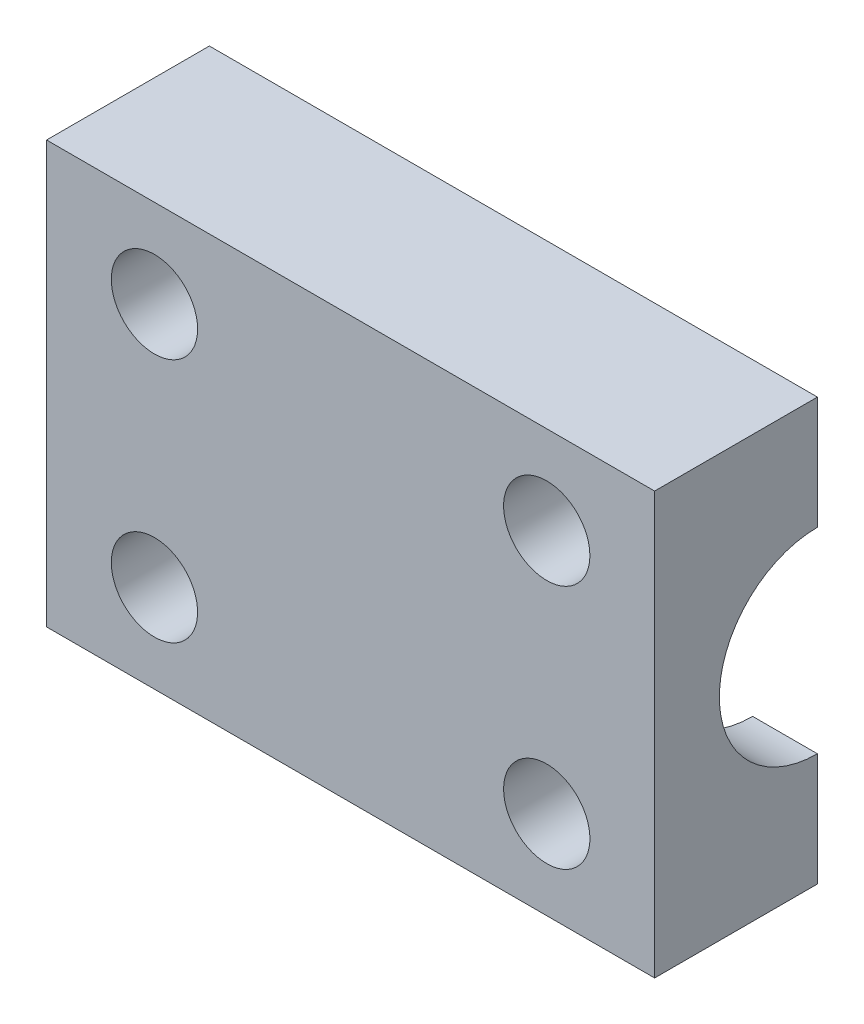
from build123d import *

# Parameters (mm, degrees)
SKETCH1_W           = 31
SKETCH1_H           = 21.5
BOSS_EXTRUDE1_DEPTH = 8.3
CUT_EXTRUDE1_DEPTH  = 6.4
CUT_EXTRUDE2_DEPTH  = 3.5
CUT_EXTRUDE3_DEPTH  = 3.5
SKETCH5_W           = 2.2
SKETCH5_H           = 8.3
SKETCH6_W           = 2.2
SKETCH6_H           = 8.3
SKETCH7_W           = 2.2
SKETCH7_H           = 8.3
SKETCH8_W           = 2.2
SKETCH8_H           = 8.3
SKETCH9_W           = 5
SKETCH9_H           = 12.3
HOLE2_D             = 10
HOLE2_DEPTH         = 31


with BuildPart() as part:
    # Sketch1 → Boss-Extrude1 (new body)
    with BuildSketch(Plane(origin=(0, 0, -8.3), x_dir=(-1, 0, 0), z_dir=(0, 0, -1))):
        with Locations((-2.5, 0)):
            Rectangle(SKETCH1_W, SKETCH1_H)
    extrude(amount=-BOSS_EXTRUDE1_DEPTH)

    # Sketch2 → Cut-Extrude1 (cut)
    with BuildSketch(Plane(origin=(5.7, 0, 0), x_dir=(0, 0, -1), z_dir=(1, 0, 0))):
        Polygon((8.3, -7.523205081), (8.3, 7.523205081), (1.834713282, 3.790470054), (1.834713282, -3.790470054), align=None)
    extrude(amount=-CUT_EXTRUDE1_DEPTH, mode=Mode.SUBTRACT)

    # Sketch3 → Cut-Extrude2 (cut)
    with BuildSketch(Plane(origin=(0, 0, -8.3), x_dir=(-1, 0, 0), z_dir=(0, 0, -1))):
        with BuildLine():
            Line((-14.7, 6.25), (-14.7, -6.25))
            ThreePointArc((-14.7, -6.25), (-12.5, -4.05), (-10.3, -6.25))
            Line((-10.3, -6.25), (-10.3, 6.25))
            ThreePointArc((-10.3, 6.25), (-12.5, 4.05), (-14.7, 6.25))
        make_face()
    extrude(amount=-CUT_EXTRUDE2_DEPTH, mode=Mode.SUBTRACT)

    # Sketch4 → Cut-Extrude3 (cut)
    with BuildSketch(Plane(origin=(0, 0, -8.3), x_dir=(-1, 0, 0), z_dir=(0, 0, -1))):
        with BuildLine():
            Line((5.3, 6.25), (5.3, -6.25))
            ThreePointArc((5.3, -6.25), (7.5, -4.05), (9.7, -6.25))
            Line((9.7, -6.25), (9.7, 6.25))
            ThreePointArc((9.7, 6.25), (7.5, 4.05), (5.3, 6.25))
        make_face()
    extrude(amount=-CUT_EXTRUDE3_DEPTH, mode=Mode.SUBTRACT)

    # Sketch5 → Cut-Revolve1 (revolve, cut)
    with BuildSketch(Plane(origin=(0, 6.25, 0), x_dir=(-1, 0, 0), z_dir=(0, 1, 0))):
        with Locations((6.4, -4.15)):
            Rectangle(SKETCH5_W, SKETCH5_H)
    revolve(axis=Axis((-7.5, 6.25, -8.3), (0, 0, 1)), mode=Mode.SUBTRACT)

    # Sketch6 → Cut-Revolve2 (revolve, cut)
    with BuildSketch(Plane(origin=(0, 6.25, 0), x_dir=(-1, 0, 0), z_dir=(0, 1, 0))):
        with Locations((-13.6, -4.15)):
            Rectangle(SKETCH6_W, SKETCH6_H)
    revolve(axis=Axis((12.5, 6.25, -8.3), (0, 0, 1)), mode=Mode.SUBTRACT)

    # Sketch7 → Cut-Revolve3 (revolve, cut)
    with BuildSketch(Plane.XZ.offset(6.25), mode=Mode.PRIVATE) as cut_revolve3_sk:
        with Locations((13.6, -4.15)):
            Rectangle(SKETCH7_W, SKETCH7_H)
    revolve(cut_revolve3_sk.sketch.rotate(Axis((12.5, -6.25, 0), (0, 0, -1)), 180), axis=Axis((12.5, -6.25, 0), (0, 0, -1)), mode=Mode.SUBTRACT)

    # Sketch8 → Cut-Revolve4 (revolve, cut)
    with BuildSketch(Plane.XZ.offset(6.25), mode=Mode.PRIVATE) as cut_revolve4_sk:
        with Locations((-6.4, -4.15)):
            Rectangle(SKETCH8_W, SKETCH8_H)
    revolve(cut_revolve4_sk.sketch.rotate(Axis((-7.5, -6.25, 0), (0, 0, -1)), 180), axis=Axis((-7.5, -6.25, 0), (0, 0, -1)), mode=Mode.SUBTRACT)

    # Sketch9 → Hole1 (revolve, cut)
    with BuildSketch(Plane(origin=(5.7, 0, -8.3), x_dir=(0, 0, 1), z_dir=(0, 1, 0))):
        with Locations((2.5, 6.15)):
            Rectangle(SKETCH9_W, SKETCH9_H)
    revolve(axis=Axis((115.7, 0, -8.3), (-1, 0, 0)), mode=Mode.SUBTRACT)

    # Hole2
    with Locations(Plane.ZY.offset(13)):
        with Locations((-8.3, 0)):
            Hole(HOLE2_D / 2, depth=HOLE2_DEPTH)


solid = part.part
